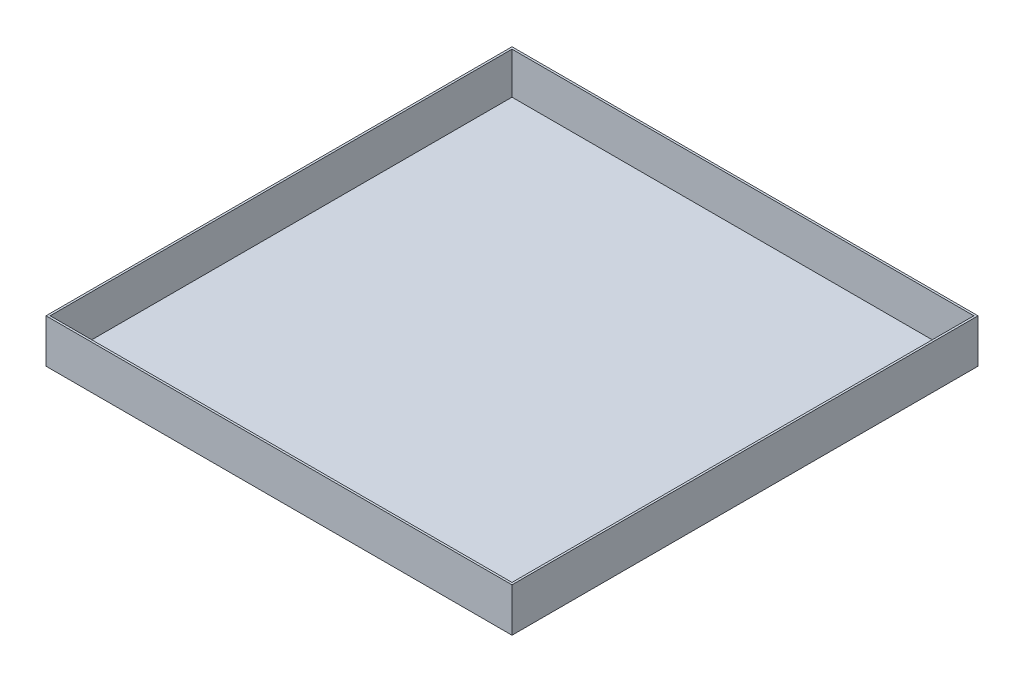
from build123d import *

# Parameters (mm, degrees)
CROQUIS1_W              = 224
CROQUIS1_H              = 224
SALIENTE_EXTRUIR1_DEPTH = 1
CROQUIS3_W              = 224
CROQUIS3_H              = 224
CROQUIS3_W_2            = 222
CROQUIS3_H_2            = 222
SALIENTE_EXTRUIR2_DEPTH = 20


with BuildPart() as part:
    # Croquis1 → Saliente-Extruir1 (new body)
    with BuildSketch(Plane(origin=(0, 0, 0), x_dir=(1, 0, 0), z_dir=(0, 1, 0))):
        Rectangle(CROQUIS1_W, CROQUIS1_H)
    extrude(amount=SALIENTE_EXTRUIR1_DEPTH)

    # Croquis3 → Saliente-Extruir2 (add)
    with BuildSketch(Plane(origin=(0, 1, 0), x_dir=(1, 0, 0), z_dir=(0, 1, 0))):
        Rectangle(CROQUIS3_W, CROQUIS3_H)
        Rectangle(CROQUIS3_W_2, CROQUIS3_H_2, mode=Mode.SUBTRACT)
    extrude(amount=SALIENTE_EXTRUIR2_DEPTH)


solid = part.part
